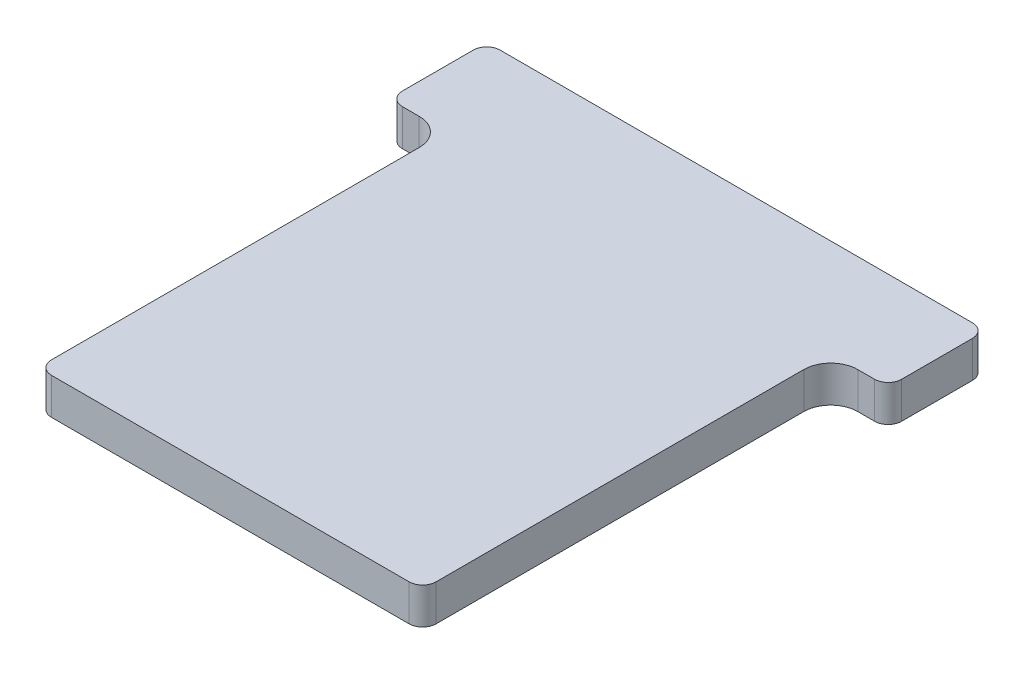
from build123d import *

# Parameters (mm, degrees)
BOSS_EXTRUDE1_DEPTH = 2.7
FILLET6_R           = 1
FILLET7_R           = 2


with BuildPart() as part:
    # Sketch1 → Boss-Extrude1 (new body)
    with BuildSketch(Plane(origin=(0, 0, 0), x_dir=(1, 0, 0), z_dir=(0, 1, 0))):
        Polygon((-14.25, 15.125), (-18.5, 15.125), (-18.5, 22.375), (18.5, 22.375), (18.5, 15.125), (14.25, 15.125), (14.25, -15.125), (-14.25, -15.125), align=None)
    extrude(amount=BOSS_EXTRUDE1_DEPTH)

    # Fillet6
    fillet6_edges = [part.edges().sort_by_distance(p)[0] for p in [
        (14.25, 1.35, 15.125),
        (-14.25, 1.35, 15.125),
        (18.5, 1.35, -22.375),
        (18.5, 1.35, -15.125),
        (-18.5, 1.35, -15.125),
        (-18.5, 1.35, -22.375),
    ]]
    fillet(fillet6_edges, radius=FILLET6_R)

    # Fillet7
    fillet7_edges = [part.edges().sort_by_distance(p)[0] for p in [
        (14.25, 1.35, -15.125),
        (-14.25, 1.35, -15.125),
    ]]
    fillet(fillet7_edges, radius=FILLET7_R)


solid = part.part
